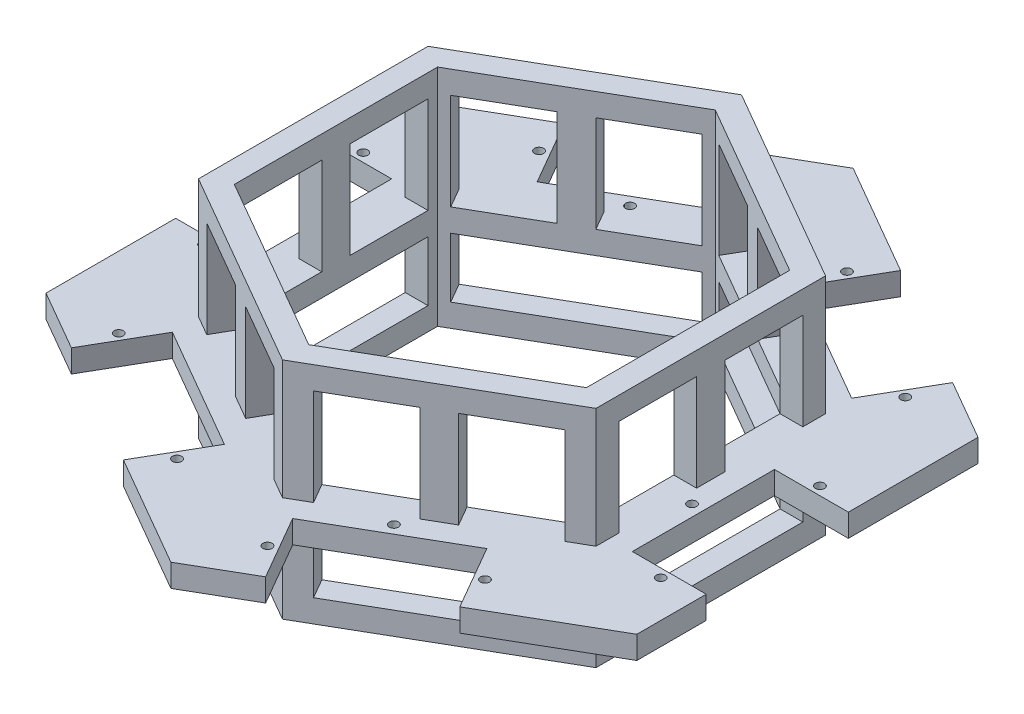
from build123d import *

# Parameters (mm, degrees)
BOSS_EXTRUDE1_DEPTH = 4
CUT_EXTRUDE1_DEPTH  = 4
SKETCH3_R           = 0.8
CUT_EXTRUDE2_DEPTH  = 4
SKETCH4_R           = 0.8
CUT_EXTRUDE3_DEPTH  = 4
BOSS_EXTRUDE2_DEPTH = 14.5
CUT_EXTRUDE4_DEPTH  = 4
SKETCH15_W          = 32.370090848
SKETCH15_H          = 10.5
CUT_EXTRUDE6_DEPTH  = 4
CIRPATTERN1_COUNT   = 6
BOSS_EXTRUDE3_DEPTH = 21
SKETCH19_W          = 32.370090848
SKETCH19_H          = 17
CUT_EXTRUDE7_DEPTH  = 4
CIRPATTERN2_COUNT   = 6
BOSS_EXTRUDE4_DEPTH = 17
CIRPATTERN3_COUNT   = 6


with BuildPart() as part:
    # Sketch1 → Boss-Extrude1 (new body)
    with BuildSketch(Plane(origin=(0, 0, 0), x_dir=(1, 0, 0), z_dir=(0, 1, 0))):
        Polygon((0, 60), (-51.961524227, 30), (-51.961524227, -30), (0, -60), (51.961524227, -30), (51.961524227, 30), align=None)
    extrude(amount=BOSS_EXTRUDE1_DEPTH)

    # Sketch2 → Cut-Extrude1 (cut)
    with BuildSketch(Plane(origin=(0, 4, 0), x_dir=(1, 0, 0), z_dir=(0, 1, 0))):
        Polygon((38.961524227, 0), (38.961524227, 7.2), (51.961524227, 7.2), (51.961524227, -17.8), (38.961524227, -17.8), align=None)
        Polygon((19.480762114, 33.741669751), (13.245379206, 37.341669751), (19.745379206, 48.6), (41.396014301, 36.1), (34.896014301, 24.841669751), align=None)
        Polygon((19.480762114, -33.741669751), (25.716145021, -30.141669751), (32.216145021, -41.4), (10.565509926, -53.9), (4.065509926, -42.641669751), align=None)
        Polygon((-19.480762114, -33.741669751), (-13.245379206, -37.341669751), (-19.745379206, -48.6), (-41.396014301, -36.1), (-34.896014301, -24.841669751), align=None)
        Polygon((-38.961524227, 0), (-38.961524227, -7.2), (-51.961524227, -7.2), (-51.961524227, 17.8), (-38.961524227, 17.8), align=None)
        Polygon((-19.480762114, 33.741669751), (-25.716145021, 30.141669751), (-32.216145021, 41.4), (-10.565509926, 53.9), (-4.065509926, 42.641669751), align=None)
    extrude(amount=-CUT_EXTRUDE1_DEPTH, mode=Mode.SUBTRACT)

    # Sketch3 → Cut-Extrude2 (cut)
    with BuildSketch(Plane(origin=(0, 4, 0), x_dir=(1, 0, 0), z_dir=(0, 1, 0))):
        with Locations((15.196341101, 43.720834875)):
            Circle(SKETCH3_R)
        with Locations((39.445052407, 29.720834875)):
            Circle(SKETCH3_R)
        with Locations((45.461524227, 8.7)):
            Circle(SKETCH3_R)
        with Locations((45.461524227, -19.3)):
            Circle(SKETCH3_R)
        with Locations((30.265183126, -35.020834875)):
            Circle(SKETCH3_R)
        with Locations((6.016471821, -49.020834875)):
            Circle(SKETCH3_R)
        with Locations((-15.196341101, -43.720834875)):
            Circle(SKETCH3_R)
        with Locations((-39.445052407, -29.720834875)):
            Circle(SKETCH3_R)
        with Locations((-45.461524227, -8.7)):
            Circle(SKETCH3_R)
        with Locations((-45.461524227, 19.3)):
            Circle(SKETCH3_R)
        with Locations((-30.265183126, 35.020834875)):
            Circle(SKETCH3_R)
        with Locations((-6.01647182, 49.020834875)):
            Circle(SKETCH3_R)
    extrude(amount=-CUT_EXTRUDE2_DEPTH, mode=Mode.SUBTRACT)

    # Sketch4 → Cut-Extrude3 (cut)
    with BuildSketch(Plane(origin=(0, 4, 0), x_dir=(1, 0, 0), z_dir=(0, 1, 0))):
        with Locations((36.961524227, -5.3)):
            Circle(SKETCH4_R)
        with Locations((13.890827473, -34.659618943)):
            Circle(SKETCH4_R)
        with Locations((-36.961524227, 5.3)):
            Circle(SKETCH4_R)
        with Locations((-13.890827473, 34.659618943)):
            Circle(SKETCH4_R)
    extrude(amount=-CUT_EXTRUDE3_DEPTH, mode=Mode.SUBTRACT)

    # Sketch12 → Boss-Extrude2 (add)
    with BuildSketch(Plane.XZ):
        Polygon((34.961524227, 0), (34.961524227, 20.185045424), (17.480762114, 30.277568136), (0, 40.370090848), (-17.480762114, 30.277568136), (-34.961524227, 20.185045424), (-34.961524227, 0), (-34.961524227, -20.185045424), (-17.480762114, -30.277568136), (0, -40.370090848), (17.480762114, -30.277568136), (34.961524227, -20.185045424), align=None)
        Polygon((-30.961524227, 0), (-30.961524227, -17.875644347), (-15.480762114, -26.813466521), (0, -35.751288694), (15.480762114, -26.813466521), (30.961524227, -17.875644347), (30.961524227, 0), (30.961524227, 17.875644347), (15.480762114, 26.813466521), (0, 35.751288694), (-15.480762114, 26.813466521), (-30.961524227, 17.875644347), align=None, mode=Mode.SUBTRACT)
    extrude(amount=BOSS_EXTRUDE2_DEPTH)

    # Sketch14 → Cut-Extrude4 (cut)
    with BuildSketch(Plane.XZ):
        Polygon((0, -35.751288694), (30.961524227, -17.875644347), (30.961524227, 17.875644347), (0, 35.751288694), (-30.961524227, 17.875644347), (-30.961524227, -17.875644347), align=None)
    extrude(amount=-CUT_EXTRUDE4_DEPTH, mode=Mode.SUBTRACT)

    # Sketch15 → Cut-Extrude6 (cut)
    with BuildSketch(Plane.ZY.offset(34.961524227)):
        with Locations((0, -5.25)):
            Rectangle(SKETCH15_W, SKETCH15_H)
    cut_extrude6 = extrude(amount=-CUT_EXTRUDE6_DEPTH, mode=Mode.SUBTRACT)

    # CirPattern1: Cut-Extrude6 ×6 about axis
    cirpattern1_axis = Axis((0, 0, 0), (0, 1, 0))
    for i in range(1, CIRPATTERN1_COUNT):
        add(cut_extrude6.rotate(cirpattern1_axis, i * 360 / CIRPATTERN1_COUNT), mode=Mode.SUBTRACT)

    # Sketch17 → Boss-Extrude3 (add)
    with BuildSketch(Plane(origin=(0, 4, 0), x_dir=(1, 0, 0), z_dir=(0, 1, 0))):
        Polygon((-34.961524227, 0), (-34.961524227, -20.185045424), (-17.480762114, -30.277568136), (0, -40.370090848), (17.480762114, -30.277568136), (34.961524227, -20.185045424), (34.961524227, 0), (34.961524227, 20.185045424), (17.480762114, 30.277568136), (0, 40.370090848), (-17.480762114, 30.277568136), (-34.961524227, 20.185045424), align=None)
        Polygon((30.961524227, -17.875644347), (30.961524227, 0), (30.961524227, 17.875644347), (15.480762114, 26.813466521), (0, 35.751288694), (-15.480762114, 26.813466521), (-30.961524227, 17.875644347), (-30.961524227, 0), (-30.961524227, -17.875644347), (-15.480762114, -26.813466521), (0, -35.751288694), (15.480762114, -26.813466521), align=None, mode=Mode.SUBTRACT)
    extrude(amount=BOSS_EXTRUDE3_DEPTH)

    # Sketch19 → Cut-Extrude7 (cut)
    with BuildSketch(Plane(origin=(17.480762114, 0, 30.277568136), x_dir=(0.8660254037844386, 0, -0.5000000000000001), z_dir=(0.5000000000000001, 0, 0.8660254037844386))):
        with Locations((0, 12.5)):
            Rectangle(SKETCH19_W, SKETCH19_H)
    cut_extrude7 = extrude(amount=-CUT_EXTRUDE7_DEPTH, mode=Mode.SUBTRACT)

    # CirPattern2: Cut-Extrude7 ×6 about axis
    cirpattern2_axis = Axis((0, 0, 0), (0, 1, 0))
    for i in range(1, CIRPATTERN2_COUNT):
        add(cut_extrude7.rotate(cirpattern2_axis, i * 360 / CIRPATTERN2_COUNT), mode=Mode.SUBTRACT)

    # Sketch23 → Boss-Extrude4 (add)
    with BuildSketch(Plane.XZ.offset(-21)):
        Polygon((15.315698604, 31.527568136), (19.645825623, 29.027568136), (17.645825623, 25.563466521), (13.315698604, 28.063466521), align=None)
    boss_extrude4 = extrude(amount=BOSS_EXTRUDE4_DEPTH)

    # CirPattern3: Boss-Extrude4 ×6 about axis
    cirpattern3_axis = Axis((0, 0, 0), (0, 1, 0))
    for i in range(1, CIRPATTERN3_COUNT):
        add(boss_extrude4.rotate(cirpattern3_axis, i * 360 / CIRPATTERN3_COUNT))


solid = part.part
